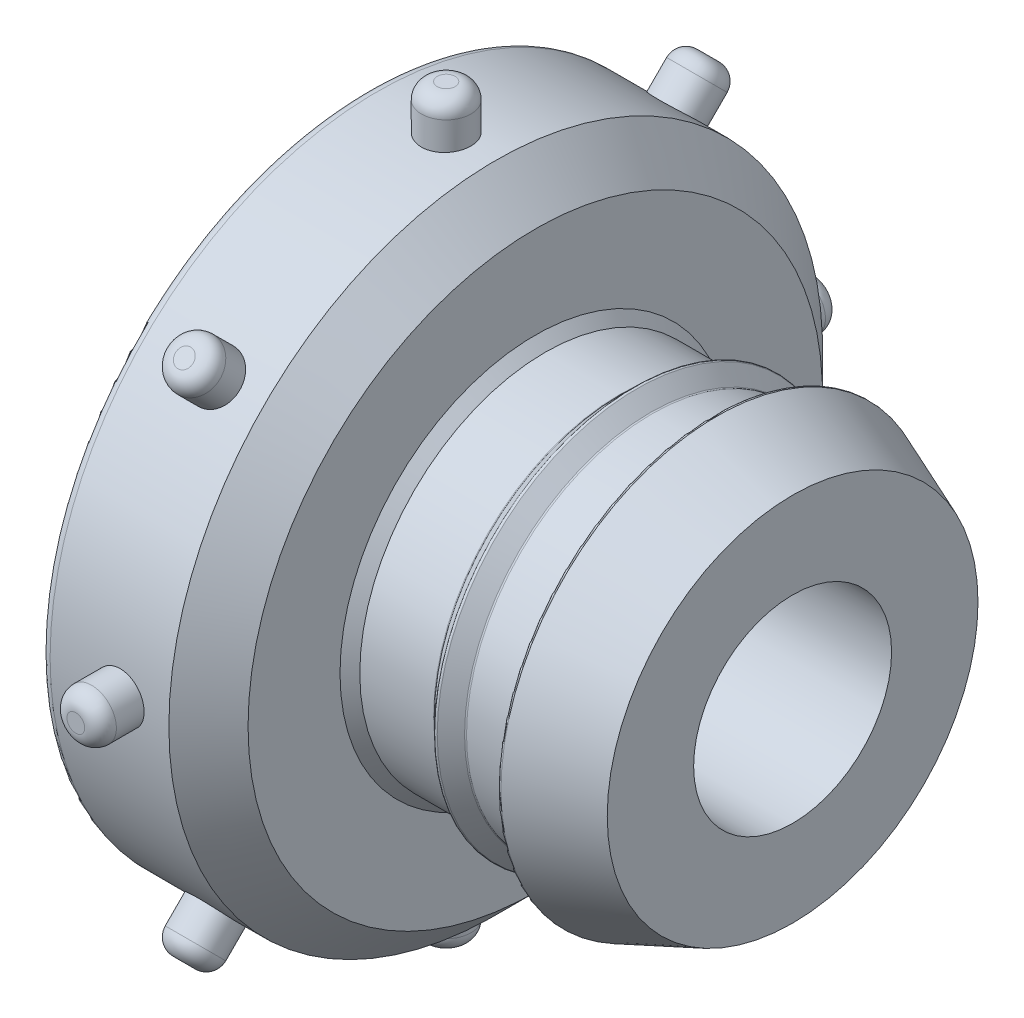
from build123d import *

# Parameters (mm, degrees)
SKETCH2_R                = 16.51
SKETCH2_R_2              = 9.365
SKETCH2_R_3              = 5
BOSS_EXTRUDE1_DEPTH      = 8.5
SKETCH4_W                = 18.18
SKETCH4_H                = 13.55
CUT_EXTRUDE1_DEPTH       = 7
SKETCH6_R                = 0.9
FILLET1_R                = 1
BOSS_EXTRUDE2_START      = -2
SKETCH7_R                = 1.25
BOSS_EXTRUDE2_DEPTH      = 4.2
FILLET2_R                = 0.8
CIRPATTERN1_COUNT        = 8
FILLET2_OF_CIRPATTERN1_R = 0.8
CHAMFER1_SIZE            = 2
FILLET3_R                = 0.5
FILLET4_R                = 0.1
CHAMFER2_SIZE            = 0.5
CUT_EXTRUDE2_DEPTH       = 30.480980309
CUT_EXTRUDE2_DEPTH_BACK  = 30.480980309
SKETCH2_3_R              = 5
CHAMFER3_SIZE            = 1
CHAMFER3_SIZE2           = 4.010780934
SKETCH8_W                = 4.09
SKETCH8_H                = 7.65
BOSS_EXTRUDE3_DEPTH      = 0.64
FILLET5_R                = 0.5


with BuildPart() as part:
    # Sketch1 → Revolve1 (revolve)
    with BuildSketch(Plane(origin=(0, 0, 0), x_dir=(1, 0, 0), z_dir=(0, 1, 0))):
        Polygon((0, 0), (-13, 0), (-13, 9.365), (-8.73, 9.365), (-7.94, 10.155), (-7.15, 9.365), (-3.97, 9.365), (-3.97, 10.955), (0, 9.365), align=None)
    revolve(axis=Axis((0, 0, 0), (-1, 0, 0)))

    # Sketch2 → Boss-Extrude1 (add)
    # profile 1 of 2: a face of its own
    with BuildSketch(Plane.ZY.offset(13)):
        Circle(SKETCH2_R)
        with Locations(Location((0, 0, 0), (0, 0, 180))):
            Circle(SKETCH2_R_2, mode=Mode.SUBTRACT)
    # profile 2 of 2: a face of its own
    with BuildSketch(Plane.ZY.offset(13)):
        with Locations(Location((0, 0, 0), (0, 0, 180))):
            Circle(SKETCH2_R_2)
        Circle(SKETCH2_R_3, mode=Mode.SUBTRACT)
    extrude(amount=BOSS_EXTRUDE1_DEPTH)

    # Sketch4 → Cut-Extrude1 (cut)
    with BuildSketch(Plane.ZY.offset(21.5)):
        with Locations((0, -0.145)):
            Rectangle(SKETCH4_W, SKETCH4_H)
    extrude(amount=-CUT_EXTRUDE1_DEPTH, mode=Mode.SUBTRACT)

    # Sketch6 → Cut-Revolve1 (revolve, cut)
    with BuildSketch(Plane.XY, mode=Mode.PRIVATE) as cut_revolve1_sk:
        with Locations((-21.5, 14.14)):
            Circle(SKETCH6_R)
    revolve(cut_revolve1_sk.sketch.rotate(Axis((-35.027065124, 0, 0), (1, 0, 0)), 90), axis=Axis((-35.027065124, 0, 0), (1, 0, 0)), mode=Mode.SUBTRACT)

    # Fillet1
    fillet1_edges = [part.edges().sort_by_distance(p)[0] for p in [
        (-21.5, 0, -13.24),
    ]]
    fillet(fillet1_edges, radius=FILLET1_R)

    # Sketch7 → Boss-Extrude2 (add)
    with BuildSketch(Plane(origin=(0, 16.51, 0), x_dir=(1, 0, 0), z_dir=(0, 1, 0)).offset(BOSS_EXTRUDE2_START)):
        with Locations(Location((-17.5, 0, 0), (0, 0, 270))):
            Circle(SKETCH7_R)
    boss_extrude2 = extrude(amount=BOSS_EXTRUDE2_DEPTH)

    # Fillet2
    fillet2_edges = [part.edges().sort_by_distance(p)[0] for p in [
        (-17.5, 18.71, -1.25),
    ]]
    fillet(fillet2_edges, radius=FILLET2_R)

    # CirPattern1: Boss-Extrude2 ×8 about axis
    cirpattern1_axis = Axis((0, 0, 0), (1, 0, 0))
    for i in range(1, CIRPATTERN1_COUNT):
        add(boss_extrude2.rotate(cirpattern1_axis, i * 360 / CIRPATTERN1_COUNT))

    # Fillet2 of CirPattern1
    fillet2_of_cirpattern1_edges = [part.edges().sort_by_distance(p)[0] for p in [
        (-17.5, 14.113851352, 12.3460844),
        (-17.5, 1.25, 18.71),
        (-17.5, -12.3460844, 14.113851352),
        (-17.5, -18.71, 1.25),
        (-17.5, -14.113851352, -12.3460844),
        (-17.5, -1.25, -18.71),
        (-17.5, 12.3460844, -14.113851352),
    ]]
    fillet(fillet2_of_cirpattern1_edges, radius=FILLET2_OF_CIRPATTERN1_R)

    # Chamfer1
    chamfer1_edges = [part.edges().sort_by_distance(p)[0] for p in [
        (-13, 0, -16.51),
    ]]
    chamfer(chamfer1_edges, length=CHAMFER1_SIZE)

    # Fillet3
    fillet3_edges = [part.edges().sort_by_distance(p)[0] for p in [
        (-21.5, 0, -16.51),
    ]]
    fillet(fillet3_edges, radius=FILLET3_R)

    # Fillet4
    fillet4_edges = [part.edges().sort_by_distance(p)[0] for p in [
        (-3.97, 0, 9.365),
        (-3.97, 0, 10.955),
        (-8.73, 0, 9.365),
        (-7.94, 0, 10.155),
        (-7.15, 0, 9.365),
    ]]
    fillet(fillet4_edges, radius=FILLET4_R)

    # Chamfer2
    chamfer2_edges = [part.edges().sort_by_distance(p)[0] for p in [
        (-13, 0, 9.365),
    ]]
    chamfer(chamfer2_edges, length=CHAMFER2_SIZE)

    # Sketch2<3> → Cut-Extrude2 (cut, two sides: drawn at the far end of the back side and taken through both)
    with BuildSketch(Plane.ZY.offset(13).offset(-CUT_EXTRUDE2_DEPTH_BACK)):
        with Locations(Location((0, 0, 0), (0, 0, 180))):
            Circle(SKETCH2_3_R)
    extrude(amount=CUT_EXTRUDE2_DEPTH + CUT_EXTRUDE2_DEPTH_BACK, mode=Mode.SUBTRACT)

    # Chamfer3
    chamfer3_edges = [part.edges().sort_by_distance(p)[0] for p in [
        (-21.5, -6.92, 0),
    ]]
    chamfer3_side = [part.faces().sort_by_distance(p)[0] for p in [
        (-21.5, 0, -12.170205593),
    ]]
    chamfer(chamfer3_edges, length=CHAMFER3_SIZE, length2=CHAMFER3_SIZE2, reference=chamfer3_side[0])

    # Sketch8 → Boss-Extrude3 (add)
    with BuildSketch(Plane.ZY.offset(14.5)):
        with Locations((-7.045, -3.095)):
            Rectangle(SKETCH8_W, SKETCH8_H)
    extrude(amount=BOSS_EXTRUDE3_DEPTH)

    # Fillet5
    fillet5_edges = [part.edges().sort_by_distance(p)[0] for p in [
        (-15.14, -3.095, -5),
        (-15.14, 0.73, -7.045),
    ]]
    fillet(fillet5_edges, radius=FILLET5_R)


solid = part.part
